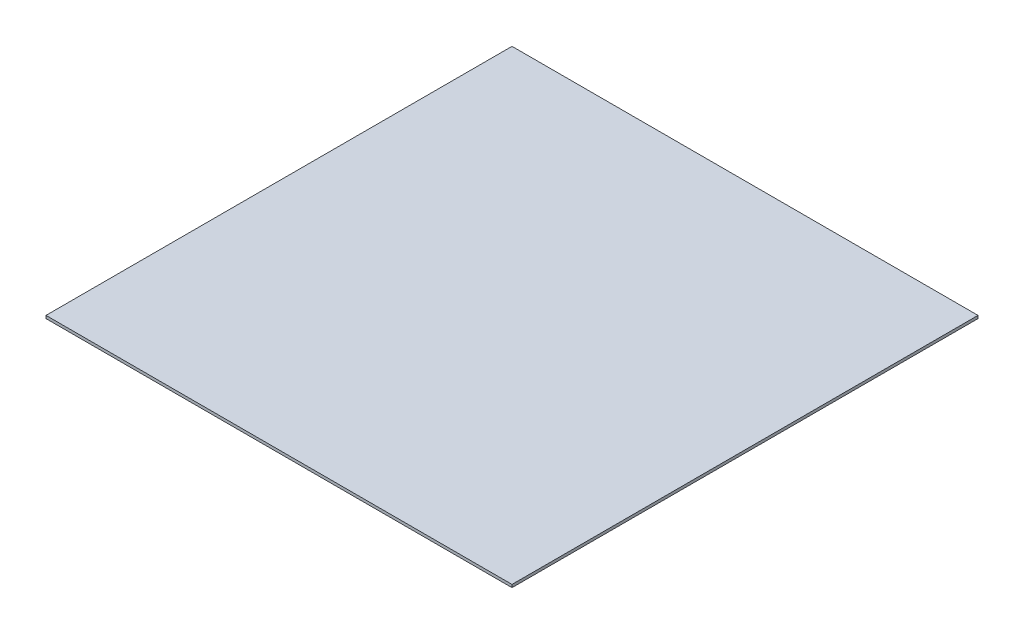
from build123d import *

# Parameters (mm, degrees)
SKETCH1_W           = 330
SKETCH1_H           = 330
BOSS_EXTRUDE1_DEPTH = 2


with BuildPart() as part:
    # Sketch1 → Boss-Extrude1 (new body)
    with BuildSketch(Plane(origin=(0, 0, 0), x_dir=(1, 0, 0), z_dir=(0, 1, 0))):
        with Locations((165, -165)):
            Rectangle(SKETCH1_W, SKETCH1_H)
    extrude(amount=BOSS_EXTRUDE1_DEPTH)


solid = part.part
